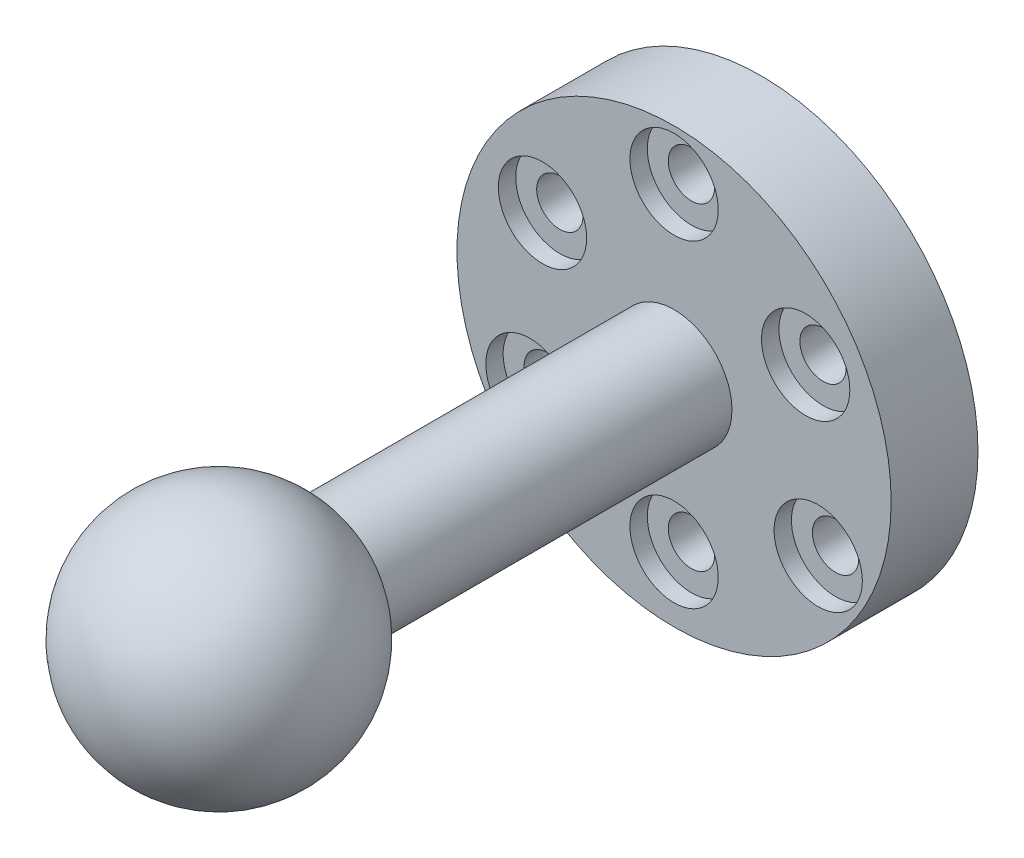
from build123d import *

# Parameters (mm, degrees)
SKETCH_1_R          = 15
EXTRUDE_1_DEPTH     = 6
SKETCH_2_R          = 1.6
CUT_EXTRUDE_1_DEPTH = 23.045407685
SKETCH_3_R          = 3.05
CUT_EXTRUDE_2_DEPTH = 1.2
SKETCH_4_R          = 4
EXTRUDE_2_DEPTH     = 25


with BuildPart() as part:
    # 草图1 → 凸台-拉伸1 (new body)
    with BuildSketch(Plane.XY):
        Circle(SKETCH_1_R)
    extrude(amount=EXTRUDE_1_DEPTH)

    # 草图2 → 切除-拉伸1 (cut, through all)
    with BuildSketch(Plane.XY.offset(6)):
        with Locations((0, 11.5)):
            Circle(SKETCH_2_R)
        with Locations((9.959292144, -5.75)):
            Circle(SKETCH_2_R)
        with Locations((-9.959292144, -5.75)):
            Circle(SKETCH_2_R)
        with Locations((-9.09326674, 5.25)):
            Circle(SKETCH_2_R)
        with Locations((9.09326674, 5.25)):
            Circle(SKETCH_2_R)
        with Locations((0, -10.5)):
            Circle(SKETCH_2_R)
    extrude(amount=-CUT_EXTRUDE_1_DEPTH, mode=Mode.SUBTRACT)

    # 草图3 → 切除-拉伸2 (cut)
    with BuildSketch(Plane.XY.offset(6)):
        with Locations((-9.09326674, 5.25)):
            Circle(SKETCH_3_R)
        with Locations((0, 11.5)):
            Circle(SKETCH_3_R)
        with Locations((9.09326674, 5.25)):
            Circle(SKETCH_3_R)
        with Locations((9.959292144, -5.75)):
            Circle(SKETCH_3_R)
        with Locations((0, -10.5)):
            Circle(SKETCH_3_R)
        with Locations((-9.959292144, -5.75)):
            Circle(SKETCH_3_R)
    extrude(amount=-CUT_EXTRUDE_2_DEPTH, mode=Mode.SUBTRACT)

    # 草图4 → 凸台-拉伸2 (add)
    with BuildSketch(Plane.XY.offset(6)):
        Circle(SKETCH_4_R)
    extrude(amount=EXTRUDE_2_DEPTH)

    # 草图5 → 旋转2 (revolve)
    with BuildSketch(Plane(origin=(0, 0, 0), x_dir=(1, 0, 0), z_dir=(0, 1, 0))):
        with BuildLine():
            Line((0, -29), (0, -45.9))
            ThreePointArc((0, -45.9), (-8.45, -37.45), (0, -29))
        make_face()
    revolve(axis=Axis((0, 0, 0), (0, 0, 1)))


solid = part.part
